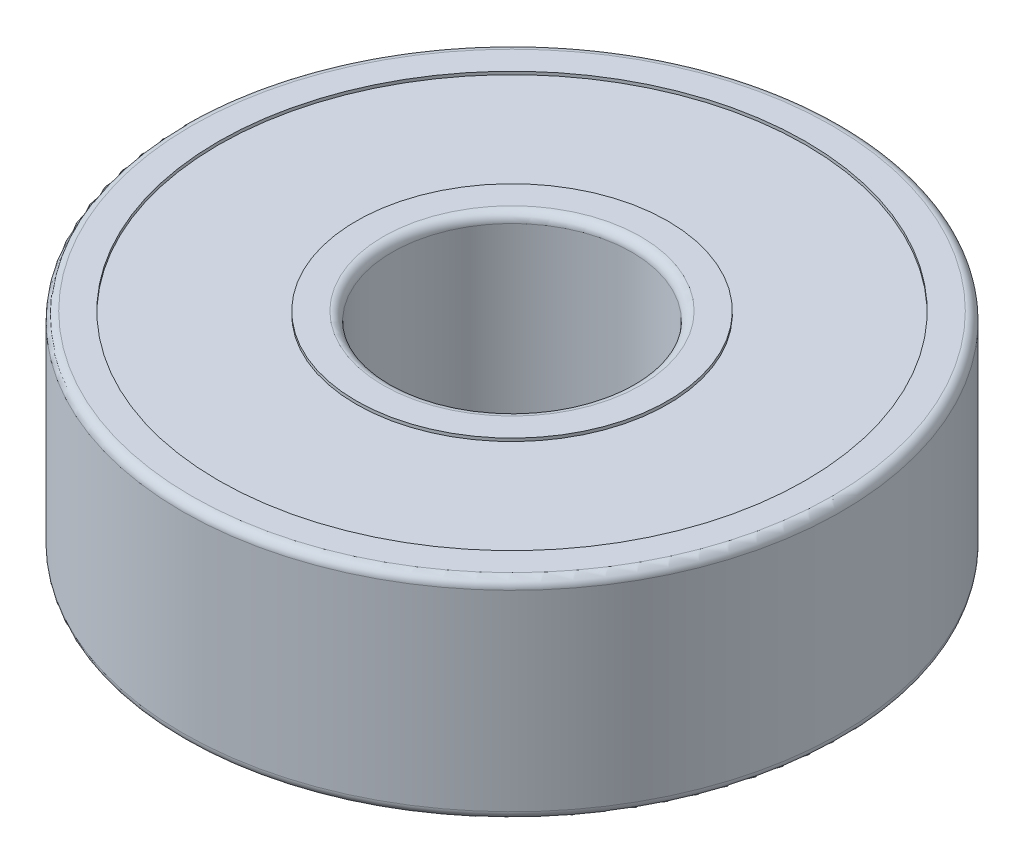
from build123d import *

# Parameters (mm, degrees)
CROQUIS1_R              = 11
CROQUIS1_R_2            = 4
SALIENTE_EXTRUIR1_DEPTH = 7
CROQUIS2_R              = 9.8
CROQUIS2_R_2            = 5.2
CORTAR_EXTRUIR1_DEPTH   = 0.1
REDONDEO1_R             = 0.3


with BuildPart() as part:
    # Croquis1 → Saliente-Extruir1 (new body)
    with BuildSketch(Plane(origin=(0, 0, 0), x_dir=(1, 0, 0), z_dir=(0, 1, 0))):
        with Locations(Location((0, 0, 0), (0, 0, 270))):
            Circle(CROQUIS1_R)
        with Locations(Location((0, 0, 0), (0, 0, 270))):
            Circle(CROQUIS1_R_2, mode=Mode.SUBTRACT)
    extrude(amount=SALIENTE_EXTRUIR1_DEPTH)

    # Croquis2 → Cortar-Extruir1 (cut)
    with BuildSketch(Plane(origin=(0, 7, 0), x_dir=(1, 0, 0), z_dir=(0, 1, 0))):
        with Locations(Location((0, 0, 0), (0, 0, 270))):
            Circle(CROQUIS2_R)
        with Locations(Location((0, 0, 0), (0, 0, 270))):
            Circle(CROQUIS2_R_2, mode=Mode.SUBTRACT)
    cortar_extruir1 = extrude(amount=-CORTAR_EXTRUIR1_DEPTH, mode=Mode.SUBTRACT)

    # Simetría1: Cortar-Extruir1 across plane
    add(cortar_extruir1.mirror(Plane.ZX.offset(3.5)), mode=Mode.SUBTRACT)

    # Redondeo1
    redondeo1_edges = [part.edges().sort_by_distance(p)[0] for p in [
        (0, 0, -11),
        (0, 7, -11),
        (0, 0, -4),
        (0, 7, -4),
    ]]
    fillet(redondeo1_edges, radius=REDONDEO1_R)


solid = part.part
